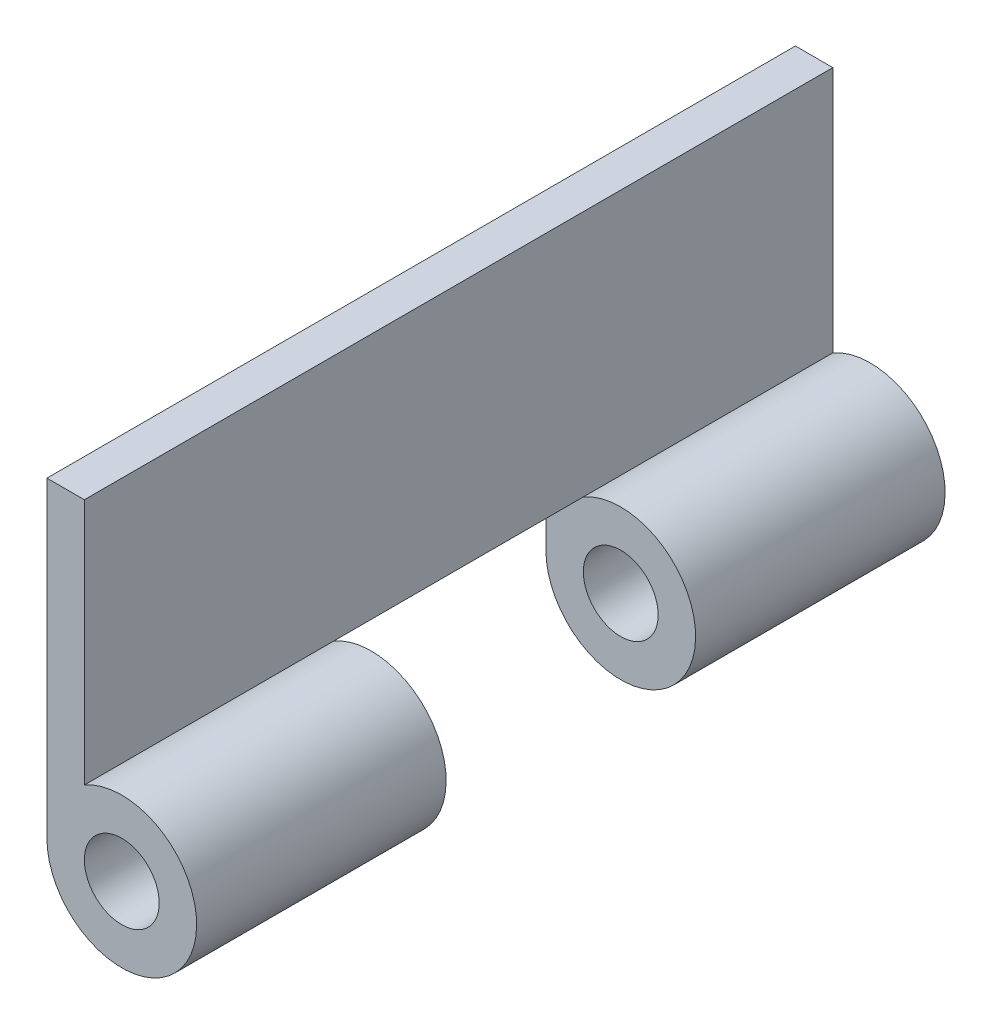
from build123d import *

# Parameters (mm, degrees)
SKETCH2_R           = 3
BOSS_EXTRUDE1_DEPTH = 60
CUT_EXTRUDE1_DEPTH  = 20


with BuildPart() as part:
    # Sketch2 → Boss-Extrude1 (new body)
    with BuildSketch(Plane.XY):
        with BuildLine():
            Line((-6, 0), (-6, 25))
            Line((-6, 25), (-3, 25))
            Line((-3, 25), (-3, 5.196152423))
            ThreePointArc((-3, 5.196152423), (5.196152423, -3), (-6, 0))
        make_face()
        Circle(SKETCH2_R, mode=Mode.SUBTRACT)
    extrude(amount=BOSS_EXTRUDE1_DEPTH)

    # Sketch3 → Cut-Extrude1 (cut)
    with BuildSketch(Plane.XY.offset(20)):
        with BuildLine():
            Line((-3, 5.196152423), (-6, 5.196152423))
            Line((-6, 5.196152423), (-6, 0))
            ThreePointArc((-6, 0), (5.196152423, -3), (-3, 5.196152423))
        make_face()
    extrude(amount=CUT_EXTRUDE1_DEPTH, mode=Mode.SUBTRACT)


solid = part.part
